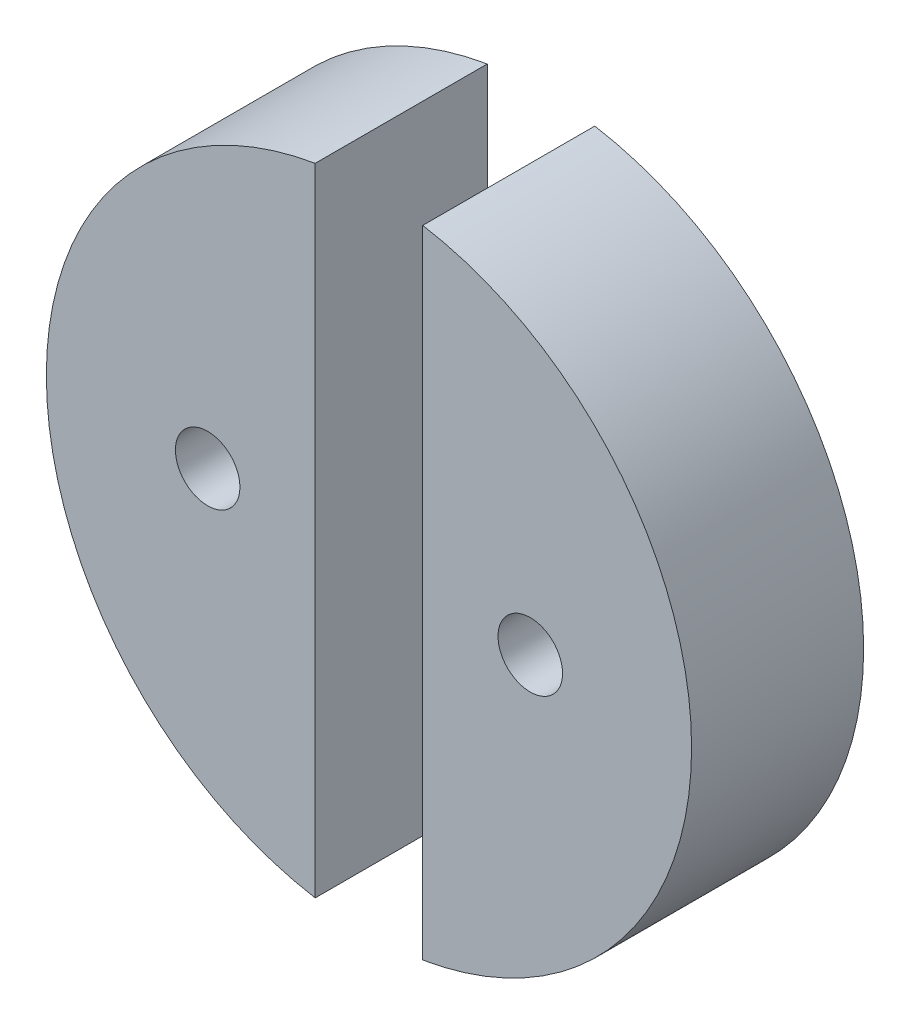
from build123d import *

# Parameters (mm, degrees)
SKETCH1_R             = 1.5
BOSS_EXTRUDE1_DEPTH   = 8
BOSS_EXTRUDE1_2_DEPTH = 8


with BuildPart() as part:
    # Sketch1 → Boss-Extrude1 (new body)
    with BuildSketch(Plane.XY):
        with BuildLine():
            Line((2.5, 0), (2.5, -14.790199458))
            ThreePointArc((2.5, -14.790199458), (15, 0), (2.5, 14.790199458))
            Line((2.5, 14.790199458), (2.5, 0))
        make_face()
        with Locations((7.5, 0)):
            Circle(SKETCH1_R, mode=Mode.SUBTRACT)
    extrude(amount=BOSS_EXTRUDE1_DEPTH)


with BuildPart() as body_2:
    # Sketch1 → Boss-Extrude1 2 (new body)
    with BuildSketch(Plane.XY):
        with BuildLine():
            Line((-2.5, 0), (-2.5, -14.790199458))
            ThreePointArc((-2.5, -14.790199458), (-15, 0), (-2.5, 14.790199458))
            Line((-2.5, 14.790199458), (-2.5, 0))
        make_face()
        with Locations((-7.5, 0)):
            Circle(SKETCH1_R, mode=Mode.SUBTRACT)
    extrude(amount=BOSS_EXTRUDE1_2_DEPTH)


solid = Compound([part.part, body_2.part])
